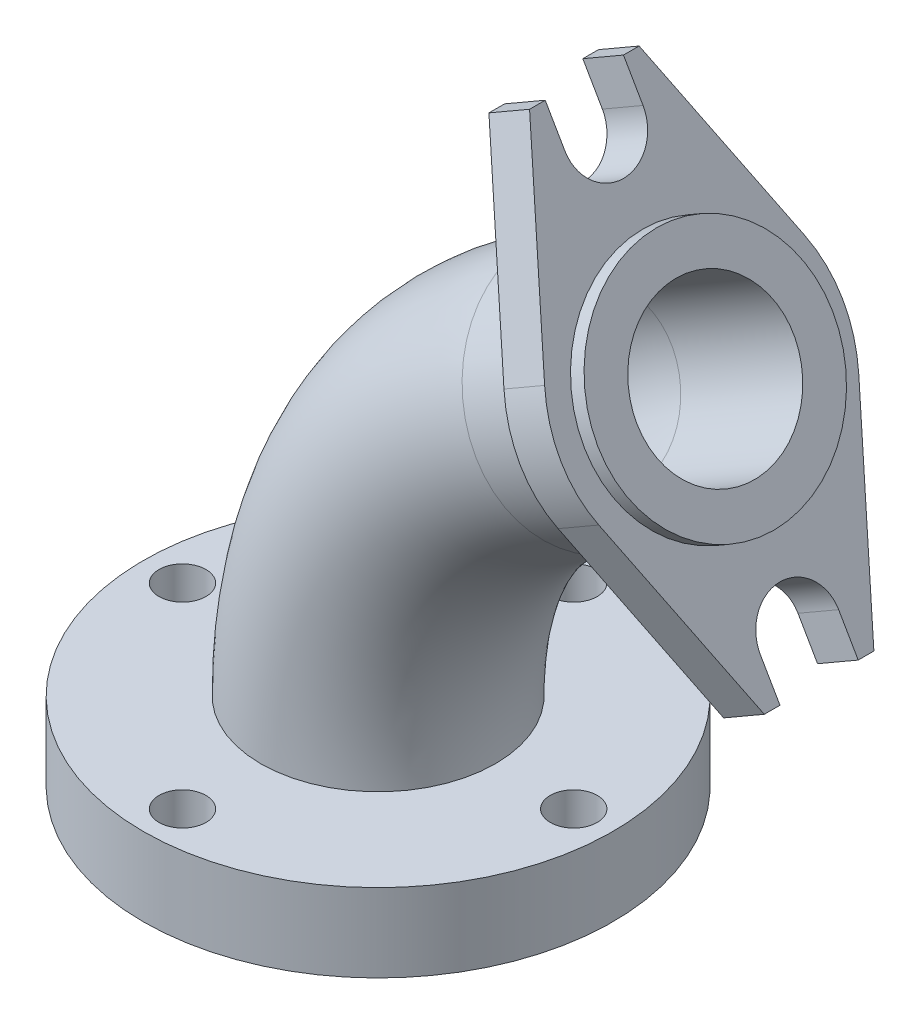
from build123d import *

# Parameters (mm, degrees)
SKETCH_1_R      = 30
SKETCH_1_R_2    = 10
SKETCH_1_R_3    = 3
EXTRUDE_1_DEPTH = 10
SKETCH_2_R      = 15
SKETCH_2_R_2    = 10
EXTRUDE_START   = -6
SKETCH_5_R      = 10
EXTRUDE_2_DEPTH = 6


with BuildPart() as part:
    # 草图1 → 凸台-拉伸1 (new body)
    with BuildSketch(Plane(origin=(0, 0, 0), x_dir=(1, 0, 0), z_dir=(0, 1, 0))):
        with Locations(Location((0, 0, 0), (0, 0, 270))):
            Circle(SKETCH_1_R)
        with Locations(Location((0, 0, 0), (0, 0, 270))):
            Circle(SKETCH_1_R_2, mode=Mode.SUBTRACT)
        with Locations(Location((25, 0, 0), (0, 0, 270))):
            Circle(SKETCH_1_R_3, mode=Mode.SUBTRACT)
        with Locations(Location((0, -25, 0), (0, 0, 270))):
            Circle(SKETCH_1_R_3, mode=Mode.SUBTRACT)
        with Locations(Location((-25, 0, 0), (0, 0, 270))):
            Circle(SKETCH_1_R_3, mode=Mode.SUBTRACT)
        with Locations(Location((0, 25, 0), (0, 0, 270))):
            Circle(SKETCH_1_R_3, mode=Mode.SUBTRACT)
    extrude(amount=EXTRUDE_1_DEPTH)

    # 扫描1: sweep along a path in 草图3
    with BuildLine(Plane.XY) as sweep_1_path:
        Line((43.088457268, 66.631397208), (27.5, 57.631397208))
        ThreePointArc((27.5, 57.631397208), (7.368602792, 37.5), (0, 10))
    # 草图2 → 扫描1 (sweep)
    with BuildSketch(Plane(origin=(0, 10, 0), x_dir=(1, 0, 0), z_dir=(0, 1, 0))):
        Circle(SKETCH_2_R)
        Circle(SKETCH_2_R_2, mode=Mode.SUBTRACT)
    sweep(path=sweep_1_path.line)

    # 草图5 → 凸台-拉伸2 (add)
    with BuildSketch(Plane(origin=(59.436533479, 34.315698604, 0), x_dir=(0, 0, -1), z_dir=(0.866025403784436, 0.5000000000000044, 0)).offset(EXTRUDE_START)):
        with BuildLine():
            Line((-7, 6.160254038), (-5, 6.160254038))
            Line((-5, 6.160254038), (-5, 11.160254038))
            ThreePointArc((-5, 11.160254038), (0, 16.160254038), (5, 11.160254038))
            Line((5, 11.160254038), (5, 6.160254038))
            Line((5, 6.160254038), (7, 6.160254038))
            Line((7, 6.160254038), (16.615384615, 29.237177115))
            ThreePointArc((16.615384615, 29.237177115), (18, 36.160254038), (16.615384615, 43.083330961))
            Line((16.615384615, 43.083330961), (7, 66.160254038))
            Line((7, 66.160254038), (5, 66.160254038))
            Line((5, 66.160254038), (5, 61.160254038))
            ThreePointArc((5, 61.160254038), (0, 56.160254038), (-5, 61.160254038))
            Line((-5, 61.160254038), (-5, 66.160254038))
            Line((-5, 66.160254038), (-7, 66.160254038))
            Line((-7, 66.160254038), (-16.615384615, 43.083330961))
            ThreePointArc((-16.615384615, 43.083330961), (-18, 36.160254038), (-16.615384615, 29.237177115))
            Line((-16.615384615, 29.237177115), (-7, 6.160254038))
        make_face()
        with Locations(Location((0, 36.160254038, 0), (0, 0, 90))):
            Circle(SKETCH_5_R, mode=Mode.SUBTRACT)
    extrude(amount=EXTRUDE_2_DEPTH)


solid = part.part
